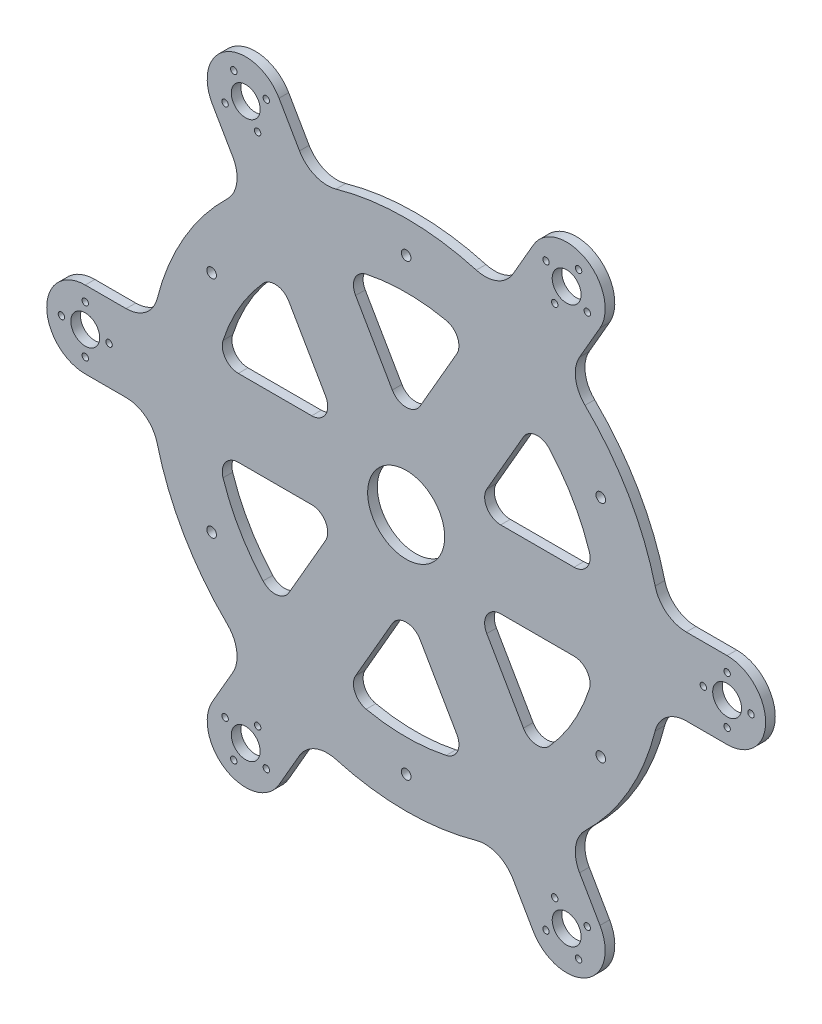
from build123d import *

# Parameters (mm, degrees)
SKETCH1_R           = 4.5
SKETCH1_R_2         = 1
SKETCH1_R_3         = 12
SKETCH1_R_4         = 1.5
BOSS_EXTRUDE1_DEPTH = 3


with BuildPart() as part:
    # Sketch1 → Boss-Extrude1 (new body)
    with BuildSketch(Plane.XY):
        with BuildLine():
            Line((-54.027153304, 69.577774511), (-60.392304845, 80.602540378))
            ThreePointArc((-60.392304845, 80.602540378), (-56, 96.994845224), (-39.607695155, 92.602540378))
            Line((-39.607695155, 92.602540378), (-33.242543613, 81.577774511))
            ThreePointArc((-33.242543613, 81.577774511), (-28.3404086, 77.310814848), (-21.850924067, 76.958021787))
            ThreePointArc((-21.850924067, 76.958021787), (0, 80), (21.850924067, 76.958021787))
            ThreePointArc((21.850924067, 76.958021787), (28.3404086, 77.310814848), (33.242543613, 81.577774511))
            Line((33.242543613, 81.577774511), (39.607695155, 92.602540378))
            ThreePointArc((39.607695155, 92.602540378), (56, 96.994845224), (60.392304845, 80.602540378))
            Line((60.392304845, 80.602540378), (54.027153304, 69.577774511))
            ThreePointArc((54.027153304, 69.577774511), (52.782925345, 63.198921225), (55.722139859, 57.402466232))
            ThreePointArc((55.722139859, 57.402466232), (69.282032303, 40), (77.573063926, 19.555555556))
            ThreePointArc((77.573063926, 19.555555556), (81.123333946, 14.111893623), (87.269696917, 12))
            Line((87.269696917, 12), (100, 12))
            ThreePointArc((100, 12), (112, 0), (100, -12))
            Line((100, -12), (87.269696917, -12))
            ThreePointArc((87.269696917, -12), (81.123333946, -14.111893623), (77.573063926, -19.555555556))
            ThreePointArc((77.573063926, -19.555555556), (69.282032303, -40), (55.722139859, -57.402466232))
            ThreePointArc((55.722139859, -57.402466232), (52.782925345, -63.198921225), (54.027153304, -69.577774511))
            Line((54.027153304, -69.577774511), (60.392304845, -80.602540378))
            ThreePointArc((60.392304845, -80.602540378), (56, -96.994845224), (39.607695155, -92.602540378))
            Line((39.607695155, -92.602540378), (33.242543613, -81.577774511))
            ThreePointArc((33.242543613, -81.577774511), (28.3404086, -77.310814848), (21.850924067, -76.958021787))
            ThreePointArc((21.850924067, -76.958021787), (0, -80), (-21.850924067, -76.958021787))
            ThreePointArc((-21.850924067, -76.958021787), (-28.3404086, -77.310814848), (-33.242543613, -81.577774511))
            Line((-33.242543613, -81.577774511), (-39.607695155, -92.602540378))
            ThreePointArc((-39.607695155, -92.602540378), (-56, -96.994845224), (-60.392304845, -80.602540378))
            Line((-60.392304845, -80.602540378), (-54.027153304, -69.577774511))
            ThreePointArc((-54.027153304, -69.577774511), (-52.782925345, -63.198921225), (-55.722139859, -57.402466232))
            ThreePointArc((-55.722139859, -57.402466232), (-69.282032303, -40), (-77.573063926, -19.555555556))
            ThreePointArc((-77.573063926, -19.555555556), (-81.123333946, -14.111893623), (-87.269696917, -12))
            Line((-87.269696917, -12), (-100, -12))
            ThreePointArc((-100, -12), (-112, 0), (-100, 12))
            Line((-100, 12), (-87.269696917, 12))
            ThreePointArc((-87.269696917, 12), (-81.123333946, 14.111893623), (-77.573063926, 19.555555556))
            ThreePointArc((-77.573063926, 19.555555556), (-69.282032303, 40), (-55.722139859, 57.402466232))
            ThreePointArc((-55.722139859, 57.402466232), (-52.782925345, 63.198921225), (-54.027153304, 69.577774511))
        make_face()
        with Locations((100, 0)):
            Circle(SKETCH1_R, mode=Mode.SUBTRACT)
        with Locations((107.425, 0)):
            Circle(SKETCH1_R_2, mode=Mode.SUBTRACT)
        with Locations((100, 7.425)):
            Circle(SKETCH1_R_2, mode=Mode.SUBTRACT)
        with Locations((92.575, 0)):
            Circle(SKETCH1_R_2, mode=Mode.SUBTRACT)
        with Locations((100, -7.425)):
            Circle(SKETCH1_R_2, mode=Mode.SUBTRACT)
        with Locations((50, -86.602540378)):
            Circle(SKETCH1_R, mode=Mode.SUBTRACT)
        with Locations((56.430238623, -82.890040378)):
            Circle(SKETCH1_R_2, mode=Mode.SUBTRACT)
        with Locations((53.7125, -93.032779002)):
            Circle(SKETCH1_R_2, mode=Mode.SUBTRACT)
        with Locations((43.569761377, -90.315040378)):
            Circle(SKETCH1_R_2, mode=Mode.SUBTRACT)
        with Locations((46.2875, -80.172301755)):
            Circle(SKETCH1_R_2, mode=Mode.SUBTRACT)
        with Locations((-50, -86.602540378)):
            Circle(SKETCH1_R, mode=Mode.SUBTRACT)
        with Locations((-43.569761377, -90.315040378)):
            Circle(SKETCH1_R_2, mode=Mode.SUBTRACT)
        with Locations((-53.7125, -93.032779002)):
            Circle(SKETCH1_R_2, mode=Mode.SUBTRACT)
        with Locations((-56.430238623, -82.890040378)):
            Circle(SKETCH1_R_2, mode=Mode.SUBTRACT)
        with Locations((-46.2875, -80.172301755)):
            Circle(SKETCH1_R_2, mode=Mode.SUBTRACT)
        with Locations((-100, 0)):
            Circle(SKETCH1_R, mode=Mode.SUBTRACT)
        with Locations((-100, -7.425)):
            Circle(SKETCH1_R_2, mode=Mode.SUBTRACT)
        with Locations((-107.425, 0)):
            Circle(SKETCH1_R_2, mode=Mode.SUBTRACT)
        with Locations((-100, 7.425)):
            Circle(SKETCH1_R_2, mode=Mode.SUBTRACT)
        with Locations((-92.575, 0)):
            Circle(SKETCH1_R_2, mode=Mode.SUBTRACT)
        with Locations((-50, 86.602540378)):
            Circle(SKETCH1_R, mode=Mode.SUBTRACT)
        with Locations((-56.430238623, 82.890040378)):
            Circle(SKETCH1_R_2, mode=Mode.SUBTRACT)
        with Locations((-53.7125, 93.032779002)):
            Circle(SKETCH1_R_2, mode=Mode.SUBTRACT)
        with Locations((-43.569761377, 90.315040378)):
            Circle(SKETCH1_R_2, mode=Mode.SUBTRACT)
        with Locations((-46.2875, 80.172301755)):
            Circle(SKETCH1_R_2, mode=Mode.SUBTRACT)
        with Locations((50, 86.602540378)):
            Circle(SKETCH1_R, mode=Mode.SUBTRACT)
        with Locations((43.569761377, 90.315040378)):
            Circle(SKETCH1_R_2, mode=Mode.SUBTRACT)
        with Locations((53.7125, 93.032779002)):
            Circle(SKETCH1_R_2, mode=Mode.SUBTRACT)
        with Locations((56.430238623, 82.890040378)):
            Circle(SKETCH1_R_2, mode=Mode.SUBTRACT)
        with Locations((46.2875, 80.172301755)):
            Circle(SKETCH1_R_2, mode=Mode.SUBTRACT)
        Circle(SKETCH1_R_3, mode=Mode.SUBTRACT)
        with Locations((0, 70)):
            Circle(SKETCH1_R_4, mode=Mode.SUBTRACT)
        with Locations((60.621778265, 35)):
            Circle(SKETCH1_R_4, mode=Mode.SUBTRACT)
        with Locations((60.621778265, -35)):
            Circle(SKETCH1_R_4, mode=Mode.SUBTRACT)
        with Locations((0, -70)):
            Circle(SKETCH1_R_4, mode=Mode.SUBTRACT)
        with Locations((-60.621778265, -35)):
            Circle(SKETCH1_R_4, mode=Mode.SUBTRACT)
        with Locations((-60.621778265, 35)):
            Circle(SKETCH1_R_4, mode=Mode.SUBTRACT)
        with BuildLine():
            Line((-36.545698507, 39.299006612), (-25.11473671, 19.5))
            ThreePointArc((-25.11473671, 19.5), (-25.11473671, 14.5), (-29.444863729, 12))
            Line((-29.444863729, 12), (-52.306787322, 12))
            ThreePointArc((-52.306787322, 12), (-56.351986497, 14.061230932), (-57.061949806, 18.545454545))
            ThreePointArc((-57.061949806, 18.545454545), (-51.961524227, 30), (-44.591809664, 40.144370849))
            ThreePointArc((-44.591809664, 40.144370849), (-40.353376444, 41.771636394), (-36.545698507, 39.299006612))
        make_face(mode=Mode.SUBTRACT)
        with BuildLine():
            Line((15.761088816, 51.299006612), (4.330127019, 31.5))
            ThreePointArc((4.330127019, 31.5), (0, 29), (-4.330127019, 31.5))
            Line((-4.330127019, 31.5), (-15.761088816, 51.299006612))
            ThreePointArc((-15.761088816, 51.299006612), (-15.998610053, 55.832867326), (-12.470140142, 58.689825394))
            ThreePointArc((-12.470140142, 58.689825394), (0, 60), (12.470140142, 58.689825394))
            ThreePointArc((12.470140142, 58.689825394), (15.998610053, 55.832867326), (15.761088816, 51.299006612))
        make_face(mode=Mode.SUBTRACT)
        with BuildLine():
            Line((36.545698507, 39.299006612), (25.11473671, 19.5))
            ThreePointArc((25.11473671, 19.5), (25.11473671, 14.5), (29.444863729, 12))
            Line((29.444863729, 12), (52.306787322, 12))
            ThreePointArc((52.306787322, 12), (56.351986497, 14.061230932), (57.061949806, 18.545454545))
            ThreePointArc((57.061949806, 18.545454545), (51.961524227, 30), (44.591809664, 40.144370849))
            ThreePointArc((44.591809664, 40.144370849), (40.353376444, 41.771636394), (36.545698507, 39.299006612))
        make_face(mode=Mode.SUBTRACT)
        with BuildLine():
            Line((52.306787322, -12), (29.444863729, -12))
            ThreePointArc((29.444863729, -12), (25.11473671, -14.5), (25.11473671, -19.5))
            Line((25.11473671, -19.5), (36.545698507, -39.299006612))
            ThreePointArc((36.545698507, -39.299006612), (40.353376444, -41.771636394), (44.591809664, -40.144370849))
            ThreePointArc((44.591809664, -40.144370849), (51.961524227, -30), (57.061949806, -18.545454545))
            ThreePointArc((57.061949806, -18.545454545), (56.351986497, -14.061230932), (52.306787322, -12))
        make_face(mode=Mode.SUBTRACT)
        with BuildLine():
            Line((15.761088816, -51.299006612), (4.330127019, -31.5))
            ThreePointArc((4.330127019, -31.5), (0, -29), (-4.330127019, -31.5))
            Line((-4.330127019, -31.5), (-15.761088816, -51.299006612))
            ThreePointArc((-15.761088816, -51.299006612), (-15.998610053, -55.832867326), (-12.470140142, -58.689825395))
            ThreePointArc((-12.470140142, -58.689825395), (0, -60), (12.470140142, -58.689825394))
            ThreePointArc((12.470140142, -58.689825394), (15.998610053, -55.832867326), (15.761088816, -51.299006612))
        make_face(mode=Mode.SUBTRACT)
        with BuildLine():
            Line((-36.545698507, -39.299006612), (-25.11473671, -19.5))
            ThreePointArc((-25.11473671, -19.5), (-25.11473671, -14.5), (-29.444863729, -12))
            Line((-29.444863729, -12), (-52.306787322, -12))
            ThreePointArc((-52.306787322, -12), (-56.351986497, -14.061230932), (-57.061949806, -18.545454545))
            ThreePointArc((-57.061949806, -18.545454545), (-51.961524227, -30), (-44.591809664, -40.144370849))
            ThreePointArc((-44.591809664, -40.144370849), (-40.353376444, -41.771636394), (-36.545698507, -39.299006612))
        make_face(mode=Mode.SUBTRACT)
    extrude(amount=BOSS_EXTRUDE1_DEPTH)


solid = part.part
